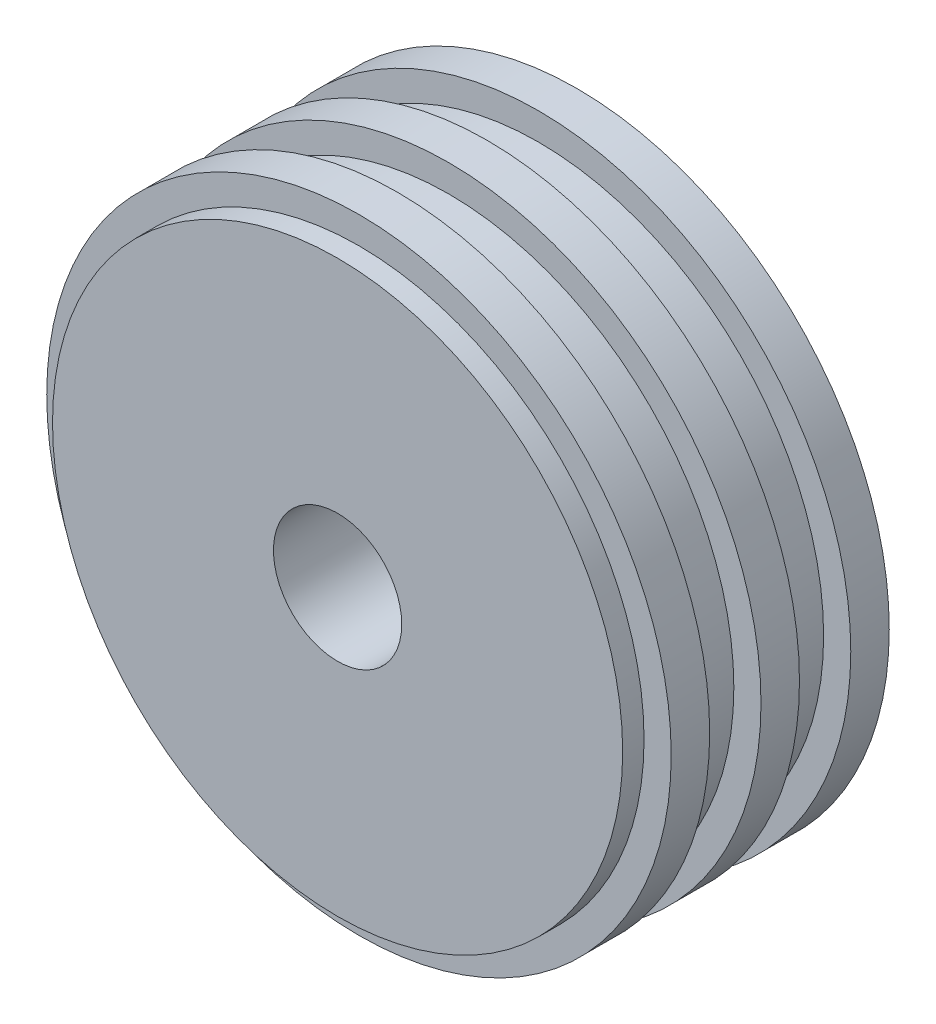
from build123d import *

# Parameters (mm, degrees)
SKETCH1_R           = 66.675
SKETCH1_R_2         = 15
BOSS_EXTRUDE1_DEPTH = 57
SKETCH2_R           = 73.025
BOSS_EXTRUDE2_DEPTH = 9
SKETCH5_R           = 15
CUT_EXTRUDE1_DEPTH  = 116.625694593
LPATTERN3_COUNT     = 3
LPATTERN3_PITCH     = 21


with BuildPart() as part:
    # Sketch1 → Boss-Extrude1 (new body)
    with BuildSketch(Plane.XY):
        Circle(SKETCH1_R)
        Circle(SKETCH1_R_2, mode=Mode.SUBTRACT)
    extrude(amount=-BOSS_EXTRUDE1_DEPTH)

    # Sketch2 → Boss-Extrude2 (add)
    with BuildSketch(Plane.XY.offset(-5)):
        Circle(SKETCH2_R)
    boss_extrude2 = extrude(amount=-BOSS_EXTRUDE2_DEPTH)

    # Sketch5 → Cut-Extrude1 (cut, through all)
    with BuildSketch(Plane.XY.offset(-5)):
        Circle(SKETCH5_R)
    extrude(amount=-CUT_EXTRUDE1_DEPTH, mode=Mode.SUBTRACT)

    # LPattern3: Boss-Extrude2 ×3
    with Locations(*[(0, 0, -i * LPATTERN3_PITCH) for i in range(1, LPATTERN3_COUNT)]):
        add(boss_extrude2)


solid = part.part
